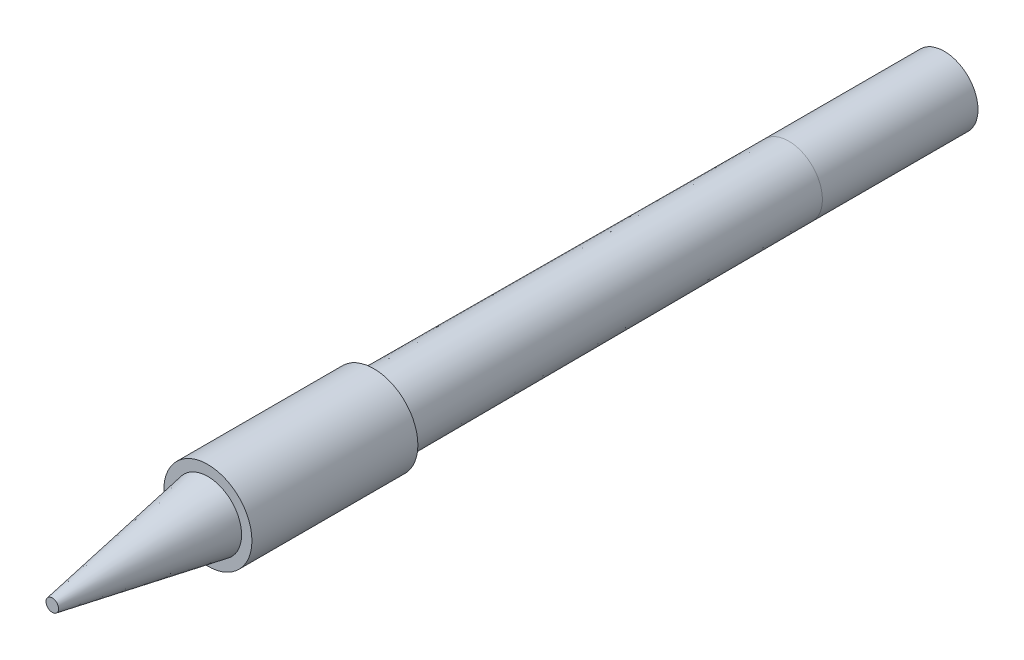
from build123d import *

# Parameters (mm, degrees)
SKETCH1_R           = 6.5
BOSS_EXTRUDE1_DEPTH = 80
BOSS_EXTRUDE1_DRAFT = -0.2
SKETCH1_2_R         = 6.5
BOSS_EXTRUDE2_DEPTH = 30
SKETCH2_R           = 8.5
BOSS_EXTRUDE3_DEPTH = 32
SKETCH3_R           = 6.5
BOSS_EXTRUDE4_DEPTH = 30
BOSS_EXTRUDE4_TAPER = 10


with BuildPart() as part:
    # Sketch1 → Boss-Extrude1 (with draft: the straight prism first)
    with BuildSketch(Plane.XY):
        Circle(SKETCH1_R)
    extrude(amount=BOSS_EXTRUDE1_DEPTH)
    # Boss-Extrude1: the draft: its side faces are tilted about the plane it starts from
    boss_extrude1_sides = [part.faces().sort_by_distance(p)[0] for p in [
        (-6.5, 0, 40),
    ]]
    draft(boss_extrude1_sides, Plane.XY, BOSS_EXTRUDE1_DRAFT)

    # Sketch1<2> → Boss-Extrude2 (add)
    with BuildSketch(Plane.XY):
        Circle(SKETCH1_2_R)
    extrude(amount=-BOSS_EXTRUDE2_DEPTH)

    # Sketch2 → Boss-Extrude3 (add)
    with BuildSketch(Plane.XY.offset(80)):
        Circle(SKETCH2_R)
    extrude(amount=BOSS_EXTRUDE3_DEPTH)

    # Sketch3 → Boss-Extrude4 (add)
    with BuildSketch(Plane.XY.offset(112)):
        Circle(SKETCH3_R)
    extrude(amount=BOSS_EXTRUDE4_DEPTH, taper=BOSS_EXTRUDE4_TAPER)


solid = part.part
